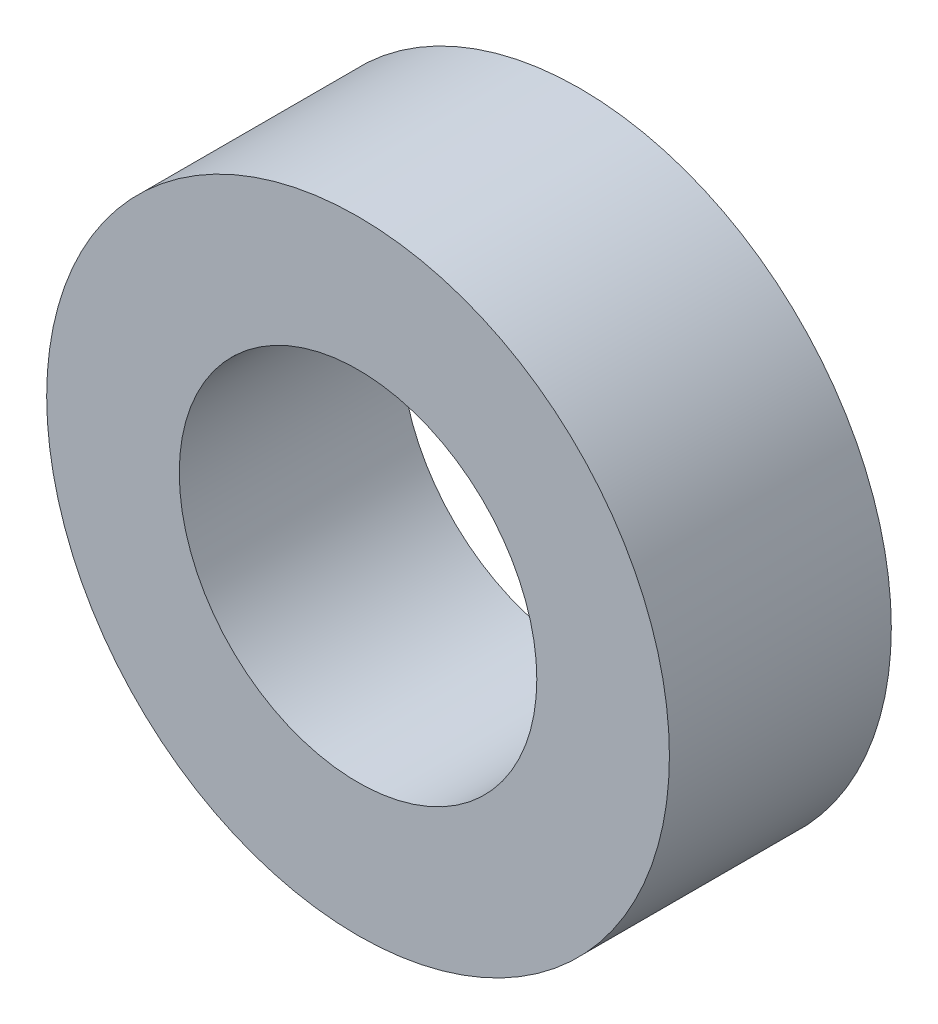
from build123d import *

# Parameters (mm, degrees)
SKETCH2_R           = 11.4046
SKETCH2_R_2         = 6.54812
BOSS_EXTRUDE1_DEPTH = 8.128


with BuildPart() as part:
    # Sketch2 → Boss-Extrude1 (new body)
    with BuildSketch(Plane.XY):
        Circle(SKETCH2_R)
        Circle(SKETCH2_R_2, mode=Mode.SUBTRACT)
    extrude(amount=BOSS_EXTRUDE1_DEPTH)


solid = part.part
